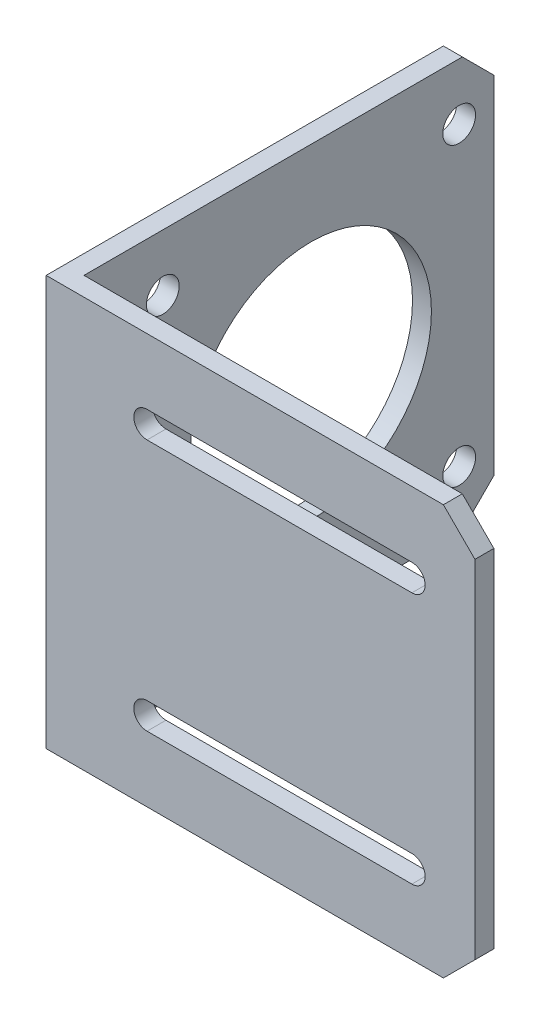
from build123d import *

# Parameters (mm, degrees)
EXTRUDE_1_DEPTH     = 65
SKETCH_2_R          = 19.1
SKETCH_2_R_2        = 2.6
CUT_EXTRUDE_1_DEPTH = 117.073252733
CUT_EXTRUDE_2_DEPTH = 115.341593482
CHAMFER_1_SIZE      = 5


with BuildPart() as part:
    # 草图1 → 凸台-拉伸1 (new body)
    with BuildSketch(Plane(origin=(0, 0, 0), x_dir=(1, 0, 0), z_dir=(0, 1, 0))):
        Polygon((0, 0), (68, 0), (68, 3), (3, 3), (3, 68), (0, 68), align=None)
    extrude(amount=EXTRUDE_1_DEPTH)

    # 草图2 → 切除-拉伸1 (cut, through all)
    with BuildSketch(Plane.ZY):
        with Locations((-39, 32.5)):
            Circle(SKETCH_2_R)
        with Locations((-62.5, 56)):
            Circle(SKETCH_2_R_2)
        with Locations((-62.5, 9)):
            Circle(SKETCH_2_R_2)
        with Locations((-15.5, 56)):
            Circle(SKETCH_2_R_2)
        with Locations((-15.5, 9)):
            Circle(SKETCH_2_R_2)
    extrude(amount=-CUT_EXTRUDE_1_DEPTH, mode=Mode.SUBTRACT)

    # 草图3 → 切除-拉伸2 (cut, through all)
    with BuildSketch(Plane(origin=(0, 0, -3), x_dir=(-1, 0, 0), z_dir=(0, 0, -1))):
        with BuildLine():
            Line((-16, 14.6), (-58, 14.6))
            ThreePointArc((-58, 14.6), (-60.1, 12.5), (-58, 10.4))
            Line((-58, 10.4), (-16, 10.4))
            ThreePointArc((-16, 10.4), (-13.9, 12.5), (-16, 14.6))
        make_face()
    cut_extrude_2 = extrude(amount=-CUT_EXTRUDE_2_DEPTH, mode=Mode.SUBTRACT)

    # 镜向1: 切除-拉伸2 across plane
    add(cut_extrude_2.mirror(Plane.ZX.offset(32.5)), mode=Mode.SUBTRACT)

    # 倒角1
    chamfer_1_edges = [part.edges().sort_by_distance(p)[0] for p in [
        (1.5, 65, -68),
        (68, 65, -1.5),
        (68, 0, -1.5),
        (1.5, 0, -68),
    ]]
    chamfer(chamfer_1_edges, length=CHAMFER_1_SIZE)


solid = part.part
